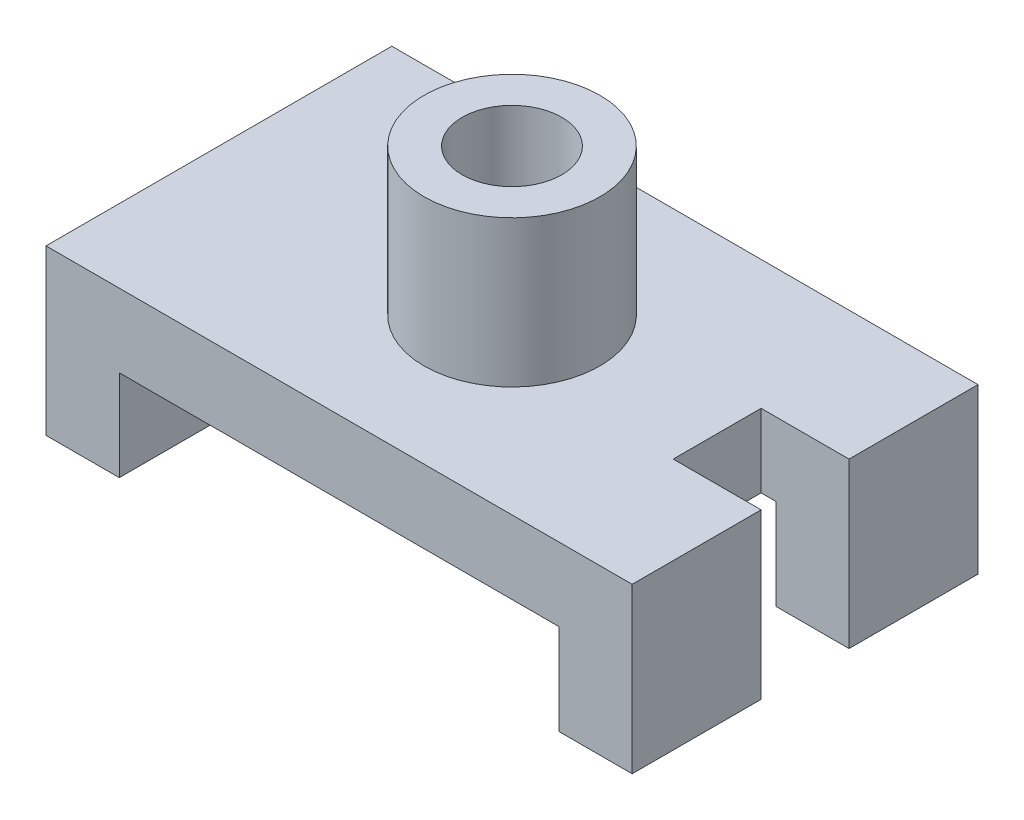
from build123d import *

# Parameters (mm, degrees)
SALIENTE_EXTRUIR2_DEPTH = 1.18
CROQUIS2_W              = 0.6
CROQUIS2_H              = 0.6
CORTAR_EXTRUIR1_DEPTH   = 5.318194067
CROQUIS3_R              = 0.6
CROQUIS3_R_2            = 0.34
SALIENTE_EXTRUIR3_DEPTH = 1


with BuildPart() as part:
    # Croquis1 → Saliente-Extruir2 (new, symmetric)
    with BuildSketch(Plane.XY):
        Polygon((-3.5, 0), (-4, 0), (-4, 1.12), (0, 1.12), (0, 0), (-0.5, 0), (-0.5, 0.62), (-3.5, 0.62), align=None)
    extrude(amount=SALIENTE_EXTRUIR2_DEPTH, both=True)

    # Croquis2 → Cortar-Extruir1 (cut, through all)
    with BuildSketch(Plane(origin=(0, 1.12, 0), x_dir=(1, 0, 0), z_dir=(0, 1, 0))):
        with Locations((-0.3, 0)):
            Rectangle(CROQUIS2_W, CROQUIS2_H)
    extrude(amount=-CORTAR_EXTRUIR1_DEPTH, mode=Mode.SUBTRACT)

    # Croquis3 → Saliente-Extruir3 (add)
    with BuildSketch(Plane(origin=(0, 1.12, 0), x_dir=(1, 0, 0), z_dir=(0, 1, 0))):
        with Locations(Location((-2, 0, 0), (0, 0, 90))):
            Circle(CROQUIS3_R)
        with Locations(Location((-2, 0, 0), (0, 0, 270))):
            Circle(CROQUIS3_R_2, mode=Mode.SUBTRACT)
    extrude(amount=SALIENTE_EXTRUIR3_DEPTH)


solid = part.part
